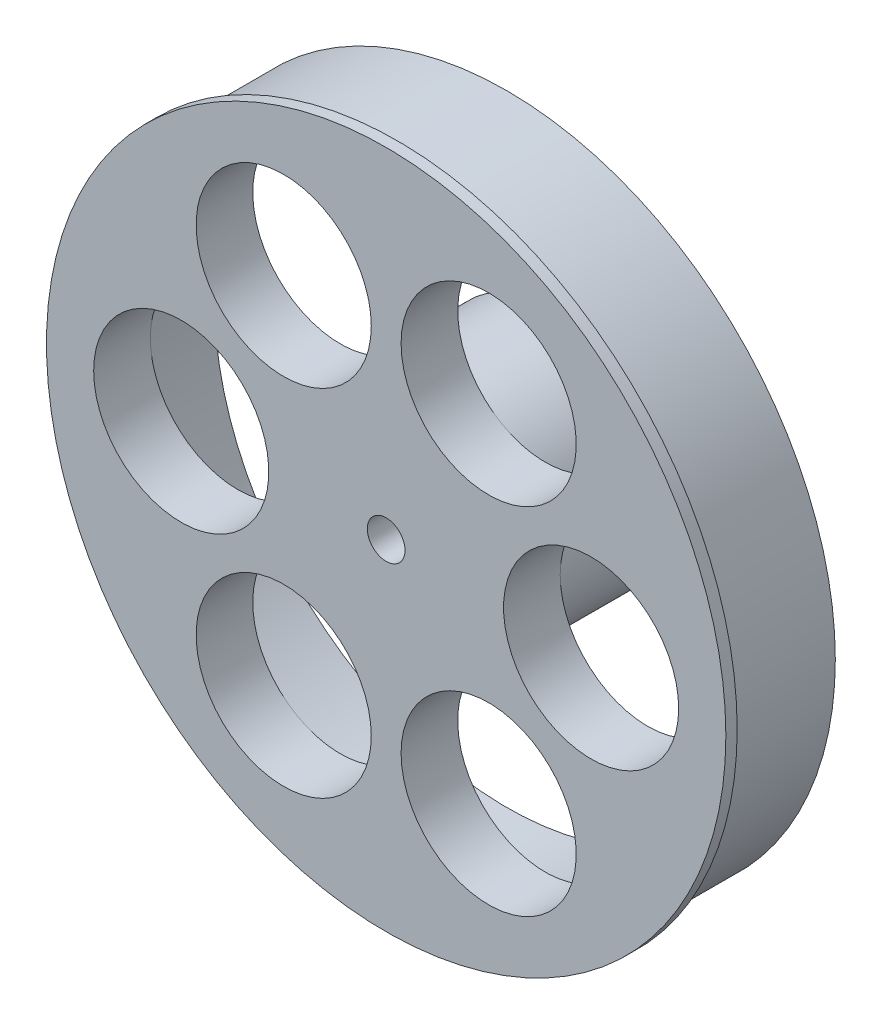
from build123d import *

# Parameters (mm, degrees)
CUT_EXTRUDE1_REACH = 15.467
SKETCH2_R          = 2.32
CIRPATTERN1_COUNT  = 6


with BuildPart() as part:
    # Sketch1 → Revolve1 (revolve)
    with BuildSketch(Plane(origin=(0, 0, 0), x_dir=(0, 0, -1), z_dir=(1, 0, 0)), mode=Mode.PRIVATE) as revolve1_sk:
        Polygon((1.5, 3.11), (4.4, 3.11), (4.4, 2.11), (2.3, 2.11), (2.3, 0.5), (0, 0.5), (0, 9), (0.3, 9), (0.3, 8.7), (3.2, 8.7), (3.2, 7.75), (1.5, 7.75), align=None)
    revolve(revolve1_sk.sketch.rotate(Axis((0, 0, 59.838000458), (0, 0, -1)), 90), axis=Axis((0, 0, 59.838000458), (0, 0, -1)))

    # Sketch2 → Cut-Extrude1 (cut, up to next)
    with BuildSketch(Plane.XY, mode=Mode.PRIVATE) as cut_extrude1_sk1:
        with Locations((5.43, 0)):
            Circle(SKETCH2_R)
    cut_extrude1_tool1 = extrude(cut_extrude1_sk1.sketch, amount=-CUT_EXTRUDE1_REACH, mode=Mode.PRIVATE) & part.part
    cut_extrude1 = cut_extrude1_tool1.solids().sort_by_distance((5.43, 0, 0))[0]
    add(cut_extrude1, mode=Mode.SUBTRACT)

    # CirPattern1: Cut-Extrude1 ×6 about axis
    cirpattern1_axis = Axis((0, 0, 0), (0, 0, 1))
    for i in range(1, CIRPATTERN1_COUNT):
        add(cut_extrude1.rotate(cirpattern1_axis, i * 360 / CIRPATTERN1_COUNT), mode=Mode.SUBTRACT)


solid = part.part
